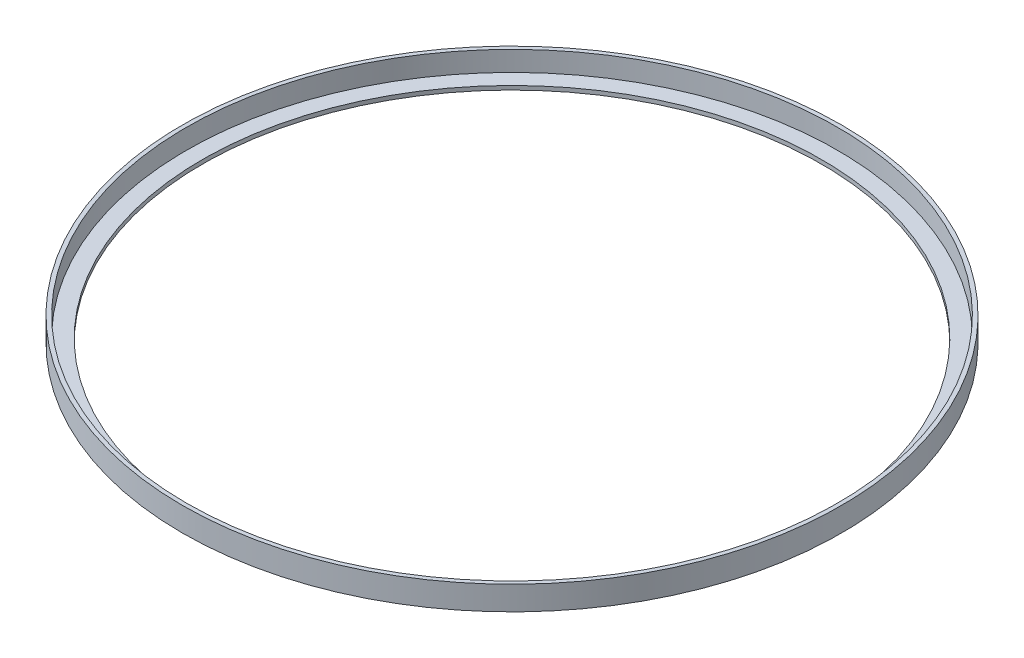
from build123d import *

# Parameters (mm, degrees)
SKETCH1_R           = 33
SKETCH1_R_2         = 31
BOSS_EXTRUDE1_DEPTH = 0.4
SKETCH2_R           = 33
SKETCH2_R_2         = 32.6
BOSS_EXTRUDE2_DEPTH = 2


with BuildPart() as part:
    # Sketch1 → Boss-Extrude1 (new body)
    with BuildSketch(Plane(origin=(0, 0, 0), x_dir=(1, 0, 0), z_dir=(0, 1, 0))):
        with Locations(Location((0, 0, 0), (0, 0, 270))):
            Circle(SKETCH1_R)
        with Locations(Location((0, 0, 0), (0, 0, 270))):
            Circle(SKETCH1_R_2, mode=Mode.SUBTRACT)
    extrude(amount=BOSS_EXTRUDE1_DEPTH)

    # Sketch2 → Boss-Extrude2 (add)
    with BuildSketch(Plane(origin=(0, 0.4, 0), x_dir=(1, 0, 0), z_dir=(0, 1, 0))):
        with Locations(Location((0, 0, 0), (0, 0, 270))):
            Circle(SKETCH2_R)
        with Locations(Location((0, 0, 0), (0, 0, 270))):
            Circle(SKETCH2_R_2, mode=Mode.SUBTRACT)
    extrude(amount=BOSS_EXTRUDE2_DEPTH)


solid = part.part
